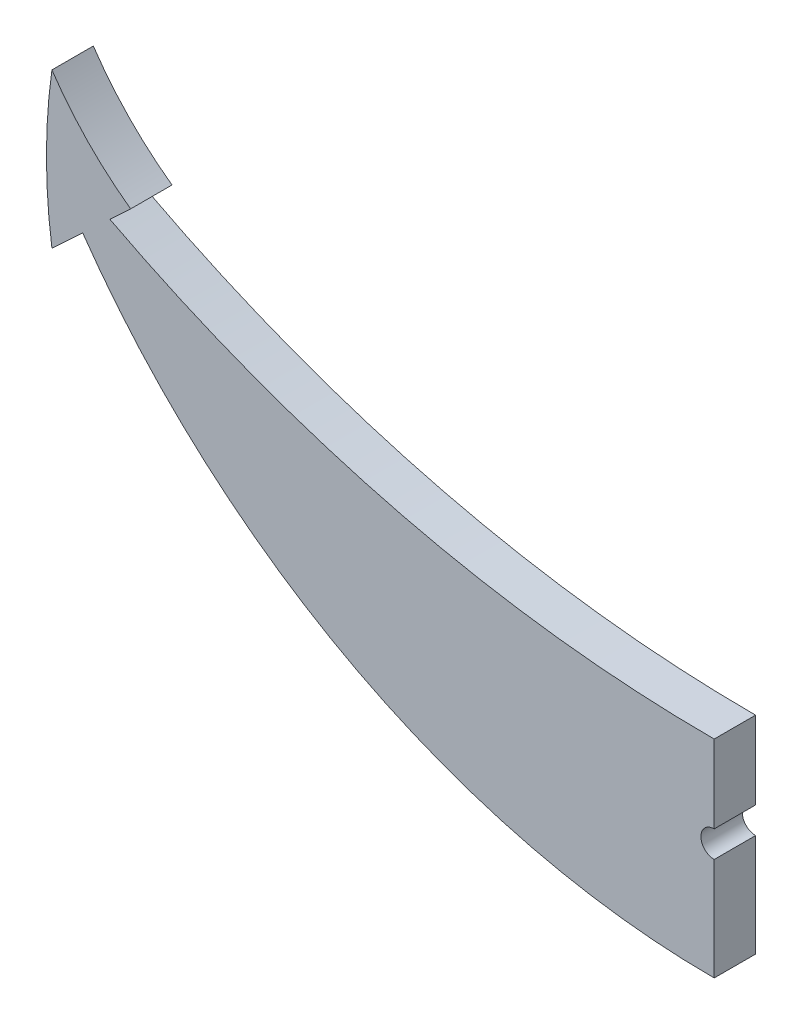
from build123d import *

# Parameters (mm, degrees)
EXTRUDE_1_DEPTH = 5


with BuildPart() as part:
    # Эскиз1 → Бобышка-Вытянуть1 (new body)
    with BuildSketch(Plane.XY):
        with BuildLine():
            Line((-80, 11.347450151), (-76.287415542, 14.809491167))
            ThreePointArc((-76.287415542, 14.809491167), (-43.024892089, -14.449127714), (0, -25))
            Line((0, -25), (0, -12.6))
            ThreePointArc((0, -12.6), (-1.6, -11), (0, -9.4))
            Line((0, -9.4), (0, 0))
            ThreePointArc((0, 0), (-37.578310294, 4.533812859), (-73, 17.875055754))
            Line((-73, 17.875055754), (-70.492401879, 20.213428832))
            ThreePointArc((-70.492401879, 20.213428832), (-75.677514984, 24.687695279), (-80, 30))
            ThreePointArc((-80, 30), (-80.662257492, 20.673725075), (-80, 11.347450151))
        make_face()
    extrude(amount=EXTRUDE_1_DEPTH)


solid = part.part
